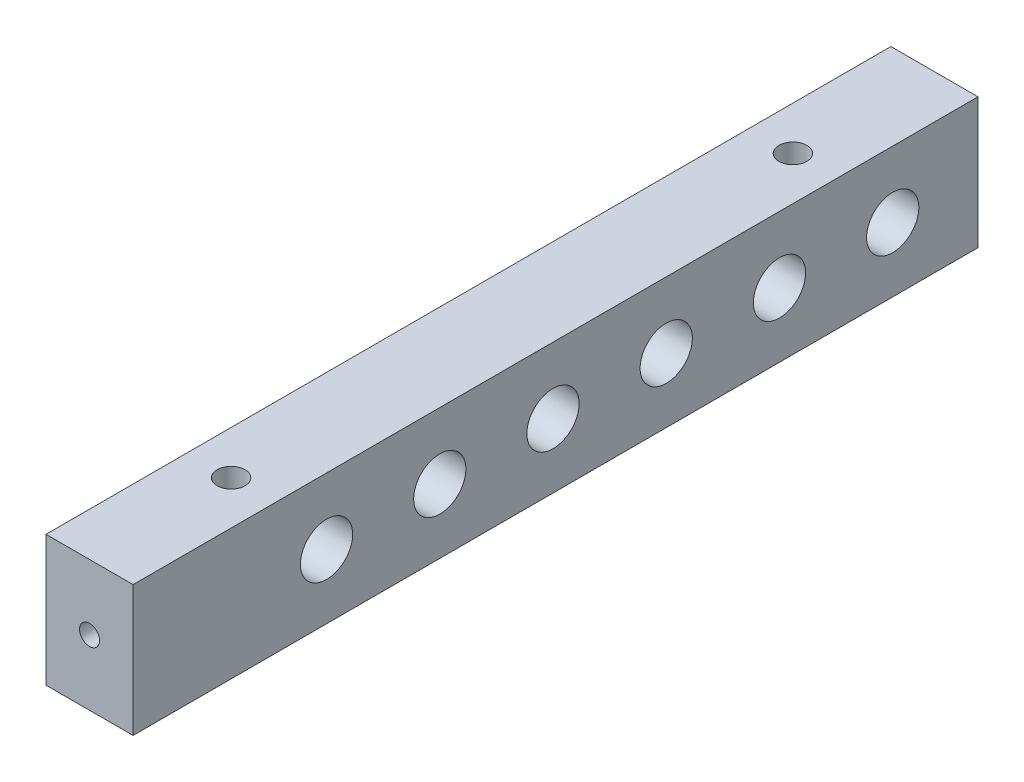
from build123d import *

# Parameters (mm, degrees)
SZKIC1_W                        = 10
SZKIC1_H                        = 15
DODANIE_WYCI_GNI_CIE1_DEPTH     = 50
SZKIC2_W                        = 10
SZKIC2_H                        = 15
DODANIE_WYCI_GNI_CIE2_DEPTH     = 47
SZKIC3_R                        = 1.6
WYTNIJ_WYCI_GNI_CIE1_DEPTH      = 54.217463596
SZKIC4_R                        = 3
WYTNIJ_WYCI_GNI_CIE2_DEPTH      = 3
SZKIC5_R                        = 1.15
WYTNIJ_WYCI_GNI_CIE3_DEPTH      = 10
WYTNIJ_WYCI_GNI_CIE4_DEPTH      = 51.91835936
WYTNIJ_WYCI_GNI_CIE4_DEPTH_BACK = 51.91835936
SZKIC7_R                        = 3


with BuildPart() as part:
    # Szkic1 → Dodanie-wyciągnięcie1 (new body)
    with BuildSketch(Plane.XY):
        with Locations((5.348837209, 0.726744186)):
            Rectangle(SZKIC1_W, SZKIC1_H)
    extrude(amount=DODANIE_WYCI_GNI_CIE1_DEPTH)

    # Szkic2 → Dodanie-wyciągnięcie2 (add)
    with BuildSketch(Plane(origin=(0, 0, 0), x_dir=(-1, 0, 0), z_dir=(0, 0, -1))):
        with Locations((-5.348837209, 0.726744186)):
            Rectangle(SZKIC2_W, SZKIC2_H)
    extrude(amount=DODANIE_WYCI_GNI_CIE2_DEPTH)

    # Szkic3 → Wytnij-wyciągnięcie1 (cut, through all)
    with BuildSketch(Plane(origin=(0, 8.226744186, 0), x_dir=(1, 0, 0), z_dir=(0, 1, 0))):
        with Locations(Location((5.348837209, 30.75, 0), (0, 0, 270))):
            Circle(SZKIC3_R)
        with Locations(Location((5.348837209, -33.75, 0), (0, 0, 270))):
            Circle(SZKIC3_R)
    extrude(amount=-WYTNIJ_WYCI_GNI_CIE1_DEPTH, mode=Mode.SUBTRACT)

    # Szkic4 → Wytnij-wyciągnięcie2 (cut)
    with BuildSketch(Plane.XZ.offset(6.773255814)):
        with Locations(Location((5.348837209, -30.75, 0), (0, 0, 270))):
            Circle(SZKIC4_R)
        with Locations(Location((5.348837209, 33.75, 0), (0, 0, 270))):
            Circle(SZKIC4_R)
    extrude(amount=-WYTNIJ_WYCI_GNI_CIE2_DEPTH, mode=Mode.SUBTRACT)

    # Szkic5 → Wytnij-wyciągnięcie3 (cut)
    with BuildSketch(Plane.XY.offset(50)):
        with Locations((5.348837209, 0.726744186)):
            Circle(SZKIC5_R)
    extrude(amount=-WYTNIJ_WYCI_GNI_CIE3_DEPTH, mode=Mode.SUBTRACT)

    # Szkic7 → Wytnij-wyciągnięcie4 (cut, two sides: drawn at the far end of the back side and taken through both)
    with BuildSketch(Plane.ZY.offset(-5.348837209).offset(-WYTNIJ_WYCI_GNI_CIE4_DEPTH_BACK)):
        with Locations((27.792952472, 0.629031613)):
            Circle(SZKIC7_R)
        with Locations((14.792952472, 0.629031613)):
            Circle(SZKIC7_R)
        with Locations((1.792952472, 0.629031613)):
            Circle(SZKIC7_R)
        with Locations((-11.207047528, 0.629031613)):
            Circle(SZKIC7_R)
        with Locations((-24.207047528, 0.629031613)):
            Circle(SZKIC7_R)
        with Locations((-37.207047528, 0.629031613)):
            Circle(SZKIC7_R)
    extrude(amount=WYTNIJ_WYCI_GNI_CIE4_DEPTH + WYTNIJ_WYCI_GNI_CIE4_DEPTH_BACK, mode=Mode.SUBTRACT)


solid = part.part
